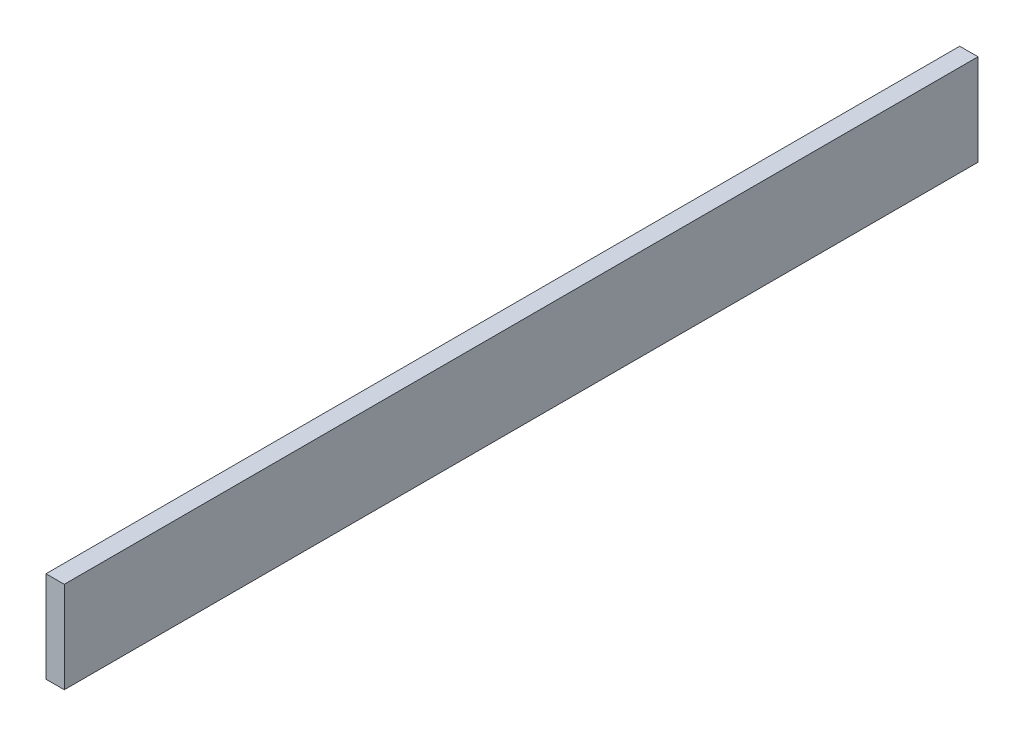
from build123d import *

# Parameters (mm, degrees)
ESQUISSE2_W        = 20
ESQUISSE2_H        = 100
BOSS_EXTRU_1_DEPTH = 1000


with BuildPart() as part:
    # Esquisse2 → Boss.-Extru.1 (new body)
    with BuildSketch(Plane.XY):
        Rectangle(ESQUISSE2_W, ESQUISSE2_H)
    extrude(amount=BOSS_EXTRU_1_DEPTH)


solid = part.part
